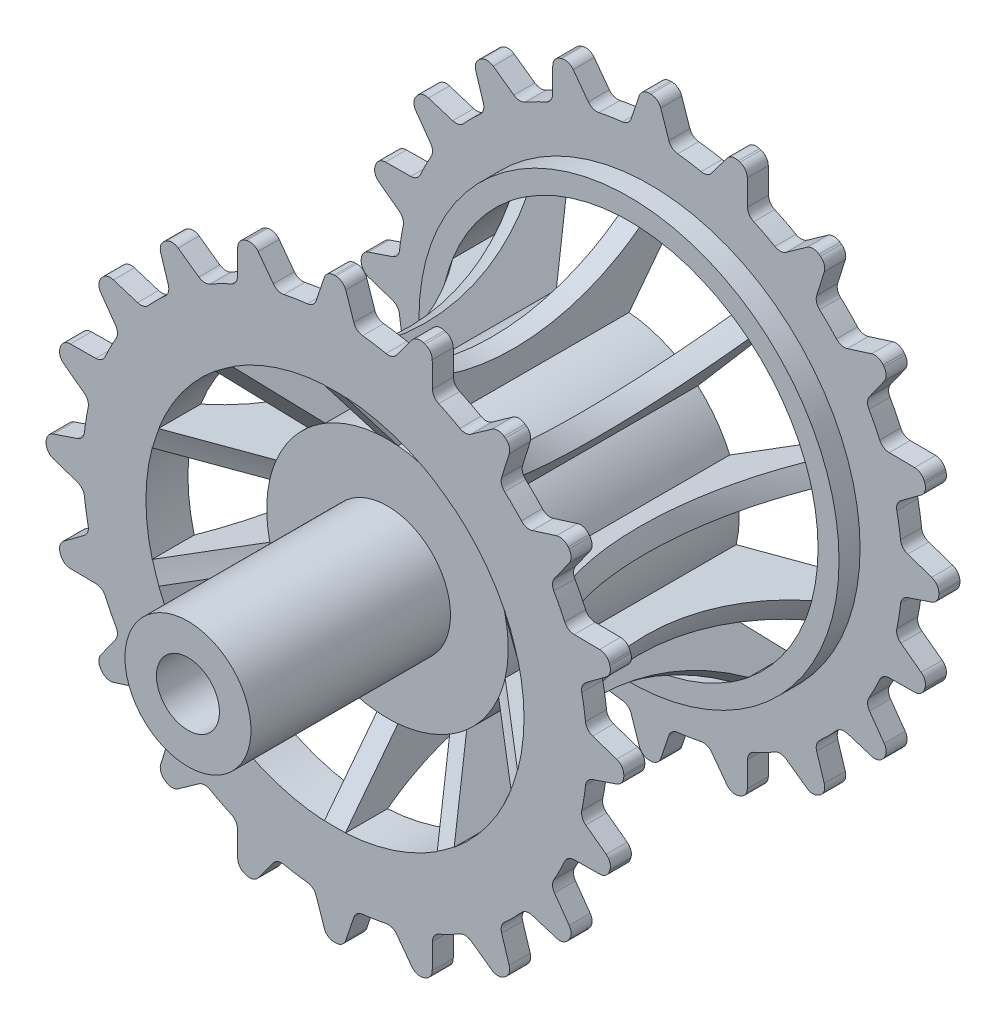
from build123d import *

# Parameters (mm, degrees)
SKETCH_1_R          = 24
EXTRUDE_1_DEPTH     = 32
SKETCH_5_R          = 5.5
CUT_EXTRUDE_1_DEPTH = 14
SKETCH_6_R          = 6
SKETCH_6_R_2        = 3
EXTRUDE_3_DEPTH     = 19
EXTRUDE_6_DEPTH     = 2
EXTRUDE_START       = -2
EXTRUDE_7_DEPTH     = 2


with BuildPart() as part:
    # 草图1 → 凸台-拉伸1 (new body)
    with BuildSketch(Plane.XY):
        Circle(SKETCH_1_R)
        with BuildLine():
            Line((-1, 17.972200756), (-1, 11.456439237))
            ThreePointArc((-1, 11.456439237), (-3.553695435, 10.937149937), (-5.924909033, 9.85623929))
            Line((-5.924909033, 9.85623929), (-9.754777561, 15.12760109))
            ThreePointArc((-9.754777561, 15.12760109), (-5.562305899, 17.119017293), (-1, 17.972200756))
        make_face(mode=Mode.SUBTRACT)
        with BuildLine():
            Line((1, 17.972200756), (1, 11.456439237))
            ThreePointArc((1, 11.456439237), (3.553695435, 10.937149937), (5.924909033, 9.85623929))
            Line((5.924909033, 9.85623929), (9.754777561, 15.12760109))
            ThreePointArc((9.754777561, 15.12760109), (5.562305899, 17.119017293), (1, 17.972200756))
        make_face(mode=Mode.SUBTRACT)
        with BuildLine():
            Line((11.37281155, 13.952030585), (7.542943022, 8.680668786))
            ThreePointArc((7.542943022, 8.680668786), (9.303695435, 6.759530401), (10.586704196, 4.491290936))
            Line((10.586704196, 4.491290936), (16.783561646, 6.504771976))
            ThreePointArc((16.783561646, 6.504771976), (14.562305899, 10.580134541), (11.37281155, 13.952030585))
        make_face(mode=Mode.SUBTRACT)
        with BuildLine():
            Line((17.401595635, 4.602658944), (11.204738185, 2.589177903))
            ThreePointArc((11.204738185, 2.589177903), (11.5, 0), (11.204738185, -2.589177903))
            Line((11.204738185, -2.589177903), (17.401595635, -4.602658944))
            ThreePointArc((17.401595635, -4.602658944), (18, 0), (17.401595635, 4.602658944))
        make_face(mode=Mode.SUBTRACT)
        with BuildLine():
            Line((16.783561646, -6.504771976), (10.586704196, -4.491290936))
            ThreePointArc((10.586704196, -4.491290936), (9.303695435, -6.759530401), (7.542943022, -8.680668786))
            Line((7.542943022, -8.680668786), (11.37281155, -13.952030585))
            ThreePointArc((11.37281155, -13.952030585), (14.562305899, -10.580134541), (16.783561646, -6.504771976))
        make_face(mode=Mode.SUBTRACT)
        with BuildLine():
            Line((9.754777561, -15.12760109), (5.924909033, -9.85623929))
            ThreePointArc((5.924909033, -9.85623929), (3.553695435, -10.937149937), (1, -11.456439237))
            Line((1, -11.456439237), (1, -17.972200756))
            ThreePointArc((1, -17.972200756), (5.562305899, -17.119017293), (9.754777561, -15.12760109))
        make_face(mode=Mode.SUBTRACT)
        with BuildLine():
            Line((-1, -17.972200756), (-1, -11.456439237))
            ThreePointArc((-1, -11.456439237), (-3.553695435, -10.937149937), (-5.924909033, -9.85623929))
            Line((-5.924909033, -9.85623929), (-9.754777561, -15.12760109))
            ThreePointArc((-9.754777561, -15.12760109), (-5.562305899, -17.119017293), (-1, -17.972200756))
        make_face(mode=Mode.SUBTRACT)
        with BuildLine():
            Line((-11.37281155, -13.952030585), (-7.542943022, -8.680668786))
            ThreePointArc((-7.542943022, -8.680668786), (-9.303695435, -6.759530401), (-10.586704196, -4.491290936))
            Line((-10.586704196, -4.491290936), (-16.783561646, -6.504771976))
            ThreePointArc((-16.783561646, -6.504771976), (-14.562305899, -10.580134541), (-11.37281155, -13.952030585))
        make_face(mode=Mode.SUBTRACT)
        with BuildLine():
            Line((-17.401595635, -4.602658944), (-11.204738185, -2.589177903))
            ThreePointArc((-11.204738185, -2.589177903), (-11.5, 0), (-11.204738185, 2.589177903))
            Line((-11.204738185, 2.589177903), (-17.401595635, 4.602658944))
            ThreePointArc((-17.401595635, 4.602658944), (-18, 0), (-17.401595635, -4.602658944))
        make_face(mode=Mode.SUBTRACT)
        with BuildLine():
            Line((-16.783561646, 6.504771976), (-10.586704196, 4.491290936))
            ThreePointArc((-10.586704196, 4.491290936), (-9.303695435, 6.759530401), (-7.542943022, 8.680668786))
            Line((-7.542943022, 8.680668786), (-11.37281155, 13.952030585))
            ThreePointArc((-11.37281155, 13.952030585), (-14.562305899, 10.580134541), (-16.783561646, 6.504771976))
        make_face(mode=Mode.SUBTRACT)
    extrude(amount=EXTRUDE_1_DEPTH)

    # 草图2 → 切除-旋转1 (revolve, cut)
    with BuildSketch(Plane(origin=(0, 0, 0), x_dir=(0, 0, -1), z_dir=(1, 0, 0)), mode=Mode.PRIVATE) as cut_revolve_1_sk:
        with BuildLine():
            Line((-30, 24), (-30, 20))
            Line((-30, 20), (-28, 20))
            Line((-28, 20), (-28, 18))
            ThreePointArc((-28, 18), (-16, 14), (-4, 18))
            Line((-4, 18), (-4, 20))
            Line((-4, 20), (-2, 20))
            Line((-2, 20), (-2, 24))
            Line((-2, 24), (-30, 24))
        make_face()
        Polygon((-5, 11.5), (-5, 0), (0, 0), (0, 18), align=None)
        Polygon((-32, 17.972200756), (-32, 0), (-27, 0), (-27, 11.5), align=None)
    revolve(cut_revolve_1_sk.sketch.rotate(Axis((0, 0, 0), (0, 0, 1)), 90), axis=Axis((0, 0, 0), (0, 0, 1)), mode=Mode.SUBTRACT)

    # 草图5 → 切除-拉伸1 (cut)
    with BuildSketch(Plane(origin=(0, 0, 5), x_dir=(-1, 0, 0), z_dir=(0, 0, -1))):
        Circle(SKETCH_5_R)
    extrude(amount=-CUT_EXTRUDE_1_DEPTH, mode=Mode.SUBTRACT)

    # 草图6 → 凸台-拉伸3 (add)
    with BuildSketch(Plane.XY.offset(27)):
        with Locations(Location((0, 0, 0), (0, 0, 180))):
            Circle(SKETCH_6_R)
        with Locations(Location((0, 0, 0), (0, 0, 180))):
            Circle(SKETCH_6_R_2, mode=Mode.SUBTRACT)
    extrude(amount=EXTRUDE_3_DEPTH)

    # 草图7 → 凸台-拉伸6 (add)
    with BuildSketch(Plane(origin=(0, 0, 0), x_dir=(-1, 0, 0), z_dir=(0, 0, -1))):
        with BuildLine():
            Line((-1.025095629, 26.818356589), (-1.793642425, 24.530751633))
            ThreePointArc((-1.793642425, 24.530751633), (-2.114118535, 24.070569501), (-2.631912696, 23.85525174))
            ThreePointArc((-2.631912696, 23.85525174), (0, 24), (2.631912696, 23.85525174))
            ThreePointArc((2.631912696, 23.85525174), (2.114118535, 24.070569501), (1.793642425, 24.530751633))
            Line((1.793642425, 24.530751633), (1.025095629, 26.818356589))
            ThreePointArc((1.025095629, 26.818356589), (0.66209506, 27.310969468), (0.080074115, 27.49988342))
            ThreePointArc((0.080074115, 27.49988342), (0, 27.5), (-0.080074115, 27.49988342))
            ThreePointArc((-0.080074115, 27.49988342), (-0.66209506, 27.310969468), (-1.025095629, 26.818356589))
        make_face()
        with BuildLine():
            Line((7.312404069, 25.82254476), (5.874563823, 23.884397181))
            ThreePointArc((5.874563823, 23.884397181), (5.427568831, 23.54577053), (4.868580473, 23.500998366))
            ThreePointArc((4.868580473, 23.500998366), (7.416407865, 22.825356391), (9.874775912, 21.874386864))
            ThreePointArc((9.874775912, 21.874386864), (9.448861249, 22.23917342), (9.286274456, 22.775865199))
            Line((9.286274456, 22.775865199), (9.262251825, 25.18900082))
            ThreePointArc((9.262251825, 25.18900082), (9.06924352, 25.769676853), (8.574086329, 26.129199062))
            ThreePointArc((8.574086329, 26.129199062), (8.497967345, 26.154054198), (8.421776311, 26.178687587))
            ThreePointArc((8.421776311, 26.178687587), (7.809863877, 26.178874105), (7.312404069, 25.82254476))
        make_face()
        with BuildLine():
            Line((14.934114709, 22.299042334), (12.967726834, 20.900071521))
            ThreePointArc((12.967726834, 20.900071521), (12.437967944, 20.716147487), (11.892503064, 20.84630353))
            ThreePointArc((11.892503064, 20.84630353), (14.106846055, 19.416407865), (16.151027261, 17.752304594))
            ThreePointArc((16.151027261, 17.752304594), (15.85868359, 18.230852094), (15.869901241, 18.791518391))
            Line((15.869901241, 18.791518391), (16.592754278, 21.093970148))
            ThreePointArc((16.592754278, 21.093970148), (16.588631235, 21.705868721), (16.228807234, 22.200806646))
            ThreePointArc((16.228807234, 22.200806646), (16.164094438, 22.247967345), (16.099244594, 22.294939414))
            ThreePointArc((16.099244594, 22.294939414), (15.517338924, 22.484208145), (14.934114709, 22.299042334))
        make_face()
        with BuildLine():
            Line((21.093970148, 16.592754278), (18.791518391, 15.869901241))
            ThreePointArc((18.791518391, 15.869901241), (18.230852094, 15.85868359), (17.752304594, 16.151027261))
            ThreePointArc((17.752304594, 16.151027261), (19.416407865, 14.106846055), (20.84630353, 11.892503064))
            ThreePointArc((20.84630353, 11.892503064), (20.716147487, 12.437967944), (20.900071521, 12.967726834))
            Line((20.900071521, 12.967726834), (22.299042334, 14.934114709))
            ThreePointArc((22.299042334, 14.934114709), (22.484208145, 15.517338924), (22.294939414, 16.099244594))
            ThreePointArc((22.294939414, 16.099244594), (22.247967345, 16.164094438), (22.200806646, 16.228807234))
            ThreePointArc((22.200806646, 16.228807234), (21.705868721, 16.588631235), (21.093970148, 16.592754278))
        make_face()
        with BuildLine():
            Line((25.18900082, 9.262251825), (22.775865199, 9.286274456))
            ThreePointArc((22.775865199, 9.286274456), (22.23917342, 9.448861249), (21.874386864, 9.874775912))
            ThreePointArc((21.874386864, 9.874775912), (22.825356391, 7.416407865), (23.500998366, 4.868580473))
            ThreePointArc((23.500998366, 4.868580473), (23.54577053, 5.427568831), (23.884397181, 5.874563823))
            Line((23.884397181, 5.874563823), (25.82254476, 7.312404069))
            ThreePointArc((25.82254476, 7.312404069), (26.178874105, 7.809863877), (26.178687587, 8.421776311))
            ThreePointArc((26.178687587, 8.421776311), (26.154054198, 8.497967345), (26.129199062, 8.574086329))
            ThreePointArc((26.129199062, 8.574086329), (25.769676853, 9.06924352), (25.18900082, 9.262251825))
        make_face()
        with BuildLine():
            Line((26.818356589, 1.025095629), (24.530751633, 1.793642425))
            ThreePointArc((24.530751633, 1.793642425), (24.070569501, 2.114118535), (23.85525174, 2.631912696))
            ThreePointArc((23.85525174, 2.631912696), (24, 0), (23.85525174, -2.631912696))
            ThreePointArc((23.85525174, -2.631912696), (24.070569501, -2.114118535), (24.530751633, -1.793642425))
            Line((24.530751633, -1.793642425), (26.818356589, -1.025095629))
            ThreePointArc((26.818356589, -1.025095629), (27.310969468, -0.66209506), (27.49988342, -0.080074115))
            ThreePointArc((27.49988342, -0.080074115), (27.5, 0), (27.49988342, 0.080074115))
            ThreePointArc((27.49988342, 0.080074115), (27.310969468, 0.66209506), (26.818356589, 1.025095629))
        make_face()
        with BuildLine():
            Line((25.82254476, -7.312404069), (23.884397181, -5.874563823))
            ThreePointArc((23.884397181, -5.874563823), (23.54577053, -5.427568831), (23.500998366, -4.868580473))
            ThreePointArc((23.500998366, -4.868580473), (22.825356391, -7.416407865), (21.874386864, -9.874775912))
            ThreePointArc((21.874386864, -9.874775912), (22.23917342, -9.448861249), (22.775865199, -9.286274456))
            Line((22.775865199, -9.286274456), (25.18900082, -9.262251825))
            ThreePointArc((25.18900082, -9.262251825), (25.769676853, -9.06924352), (26.129199062, -8.574086329))
            ThreePointArc((26.129199062, -8.574086329), (26.154054198, -8.497967345), (26.178687587, -8.421776311))
            ThreePointArc((26.178687587, -8.421776311), (26.178874105, -7.809863877), (25.82254476, -7.312404069))
        make_face()
        with BuildLine():
            Line((22.299042334, -14.934114709), (20.900071521, -12.967726834))
            ThreePointArc((20.900071521, -12.967726834), (20.716147487, -12.437967944), (20.84630353, -11.892503064))
            ThreePointArc((20.84630353, -11.892503064), (19.416407865, -14.106846055), (17.752304594, -16.151027261))
            ThreePointArc((17.752304594, -16.151027261), (18.230852094, -15.85868359), (18.791518391, -15.869901241))
            Line((18.791518391, -15.869901241), (21.093970148, -16.592754278))
            ThreePointArc((21.093970148, -16.592754278), (21.705868721, -16.588631235), (22.200806646, -16.228807234))
            ThreePointArc((22.200806646, -16.228807234), (22.247967345, -16.164094438), (22.294939414, -16.099244594))
            ThreePointArc((22.294939414, -16.099244594), (22.484208145, -15.517338924), (22.299042334, -14.934114709))
        make_face()
        with BuildLine():
            Line((16.592754278, -21.093970148), (15.869901241, -18.791518391))
            ThreePointArc((15.869901241, -18.791518391), (15.85868359, -18.230852094), (16.151027261, -17.752304594))
            ThreePointArc((16.151027261, -17.752304594), (14.106846055, -19.416407865), (11.892503064, -20.84630353))
            ThreePointArc((11.892503064, -20.84630353), (12.437967944, -20.716147487), (12.967726834, -20.900071521))
            Line((12.967726834, -20.900071521), (14.934114709, -22.299042334))
            ThreePointArc((14.934114709, -22.299042334), (15.517338924, -22.484208145), (16.099244594, -22.294939414))
            ThreePointArc((16.099244594, -22.294939414), (16.164094438, -22.247967345), (16.228807234, -22.200806646))
            ThreePointArc((16.228807234, -22.200806646), (16.588631235, -21.705868721), (16.592754278, -21.093970148))
        make_face()
        with BuildLine():
            Line((9.262251825, -25.18900082), (9.286274456, -22.775865199))
            ThreePointArc((9.286274456, -22.775865199), (9.448861249, -22.23917342), (9.874775912, -21.874386864))
            ThreePointArc((9.874775912, -21.874386864), (7.416407865, -22.825356391), (4.868580473, -23.500998366))
            ThreePointArc((4.868580473, -23.500998366), (5.427568831, -23.54577053), (5.874563823, -23.884397181))
            Line((5.874563823, -23.884397181), (7.312404069, -25.82254476))
            ThreePointArc((7.312404069, -25.82254476), (7.809863877, -26.178874105), (8.421776311, -26.178687587))
            ThreePointArc((8.421776311, -26.178687587), (8.497967345, -26.154054198), (8.574086329, -26.129199062))
            ThreePointArc((8.574086329, -26.129199062), (9.06924352, -25.769676853), (9.262251825, -25.18900082))
        make_face()
        with BuildLine():
            Line((1.025095629, -26.818356589), (1.793642425, -24.530751633))
            ThreePointArc((1.793642425, -24.530751633), (2.114118535, -24.070569501), (2.631912696, -23.85525174))
            ThreePointArc((2.631912696, -23.85525174), (0, -24), (-2.631912696, -23.85525174))
            ThreePointArc((-2.631912696, -23.85525174), (-2.114118535, -24.070569501), (-1.793642425, -24.530751633))
            Line((-1.793642425, -24.530751633), (-1.025095629, -26.818356589))
            ThreePointArc((-1.025095629, -26.818356589), (-0.66209506, -27.310969468), (-0.080074115, -27.49988342))
            ThreePointArc((-0.080074115, -27.49988342), (0, -27.5), (0.080074115, -27.49988342))
            ThreePointArc((0.080074115, -27.49988342), (0.66209506, -27.310969468), (1.025095629, -26.818356589))
        make_face()
        with BuildLine():
            Line((-7.312404069, -25.82254476), (-5.874563823, -23.884397181))
            ThreePointArc((-5.874563823, -23.884397181), (-5.427568831, -23.54577053), (-4.868580473, -23.500998366))
            ThreePointArc((-4.868580473, -23.500998366), (-7.416407865, -22.825356391), (-9.874775912, -21.874386864))
            ThreePointArc((-9.874775912, -21.874386864), (-9.448861249, -22.23917342), (-9.286274456, -22.775865199))
            Line((-9.286274456, -22.775865199), (-9.262251825, -25.18900082))
            ThreePointArc((-9.262251825, -25.18900082), (-9.06924352, -25.769676853), (-8.574086329, -26.129199062))
            ThreePointArc((-8.574086329, -26.129199062), (-8.497967345, -26.154054198), (-8.421776311, -26.178687587))
            ThreePointArc((-8.421776311, -26.178687587), (-7.809863877, -26.178874105), (-7.312404069, -25.82254476))
        make_face()
        with BuildLine():
            Line((-14.934114709, -22.299042334), (-12.967726834, -20.900071521))
            ThreePointArc((-12.967726834, -20.900071521), (-12.437967944, -20.716147487), (-11.892503064, -20.84630353))
            ThreePointArc((-11.892503064, -20.84630353), (-14.106846055, -19.416407865), (-16.151027261, -17.752304594))
            ThreePointArc((-16.151027261, -17.752304594), (-15.85868359, -18.230852094), (-15.869901241, -18.791518391))
            Line((-15.869901241, -18.791518391), (-16.592754278, -21.093970148))
            ThreePointArc((-16.592754278, -21.093970148), (-16.588631235, -21.705868721), (-16.228807234, -22.200806646))
            ThreePointArc((-16.228807234, -22.200806646), (-16.164094438, -22.247967345), (-16.099244594, -22.294939414))
            ThreePointArc((-16.099244594, -22.294939414), (-15.517338924, -22.484208145), (-14.934114709, -22.299042334))
        make_face()
        with BuildLine():
            Line((-21.093970148, -16.592754278), (-18.791518391, -15.869901241))
            ThreePointArc((-18.791518391, -15.869901241), (-18.230852094, -15.85868359), (-17.752304594, -16.151027261))
            ThreePointArc((-17.752304594, -16.151027261), (-19.416407865, -14.106846055), (-20.84630353, -11.892503064))
            ThreePointArc((-20.84630353, -11.892503064), (-20.716147487, -12.437967944), (-20.900071521, -12.967726834))
            Line((-20.900071521, -12.967726834), (-22.299042334, -14.934114709))
            ThreePointArc((-22.299042334, -14.934114709), (-22.484208145, -15.517338924), (-22.294939414, -16.099244594))
            ThreePointArc((-22.294939414, -16.099244594), (-22.247967345, -16.164094438), (-22.200806646, -16.228807234))
            ThreePointArc((-22.200806646, -16.228807234), (-21.705868721, -16.588631235), (-21.093970148, -16.592754278))
        make_face()
        with BuildLine():
            Line((-25.18900082, -9.262251825), (-22.775865199, -9.286274456))
            ThreePointArc((-22.775865199, -9.286274456), (-22.23917342, -9.448861249), (-21.874386864, -9.874775912))
            ThreePointArc((-21.874386864, -9.874775912), (-22.825356391, -7.416407865), (-23.500998366, -4.868580473))
            ThreePointArc((-23.500998366, -4.868580473), (-23.54577053, -5.427568831), (-23.884397181, -5.874563823))
            Line((-23.884397181, -5.874563823), (-25.82254476, -7.312404069))
            ThreePointArc((-25.82254476, -7.312404069), (-26.178874105, -7.809863877), (-26.178687587, -8.421776311))
            ThreePointArc((-26.178687587, -8.421776311), (-26.154054198, -8.497967345), (-26.129199062, -8.574086329))
            ThreePointArc((-26.129199062, -8.574086329), (-25.769676853, -9.06924352), (-25.18900082, -9.262251825))
        make_face()
        with BuildLine():
            Line((-26.818356589, -1.025095629), (-24.530751633, -1.793642425))
            ThreePointArc((-24.530751633, -1.793642425), (-24.070569501, -2.114118535), (-23.85525174, -2.631912696))
            ThreePointArc((-23.85525174, -2.631912696), (-24, 0), (-23.85525174, 2.631912696))
            ThreePointArc((-23.85525174, 2.631912696), (-24.070569501, 2.114118535), (-24.530751633, 1.793642425))
            Line((-24.530751633, 1.793642425), (-26.818356589, 1.025095629))
            ThreePointArc((-26.818356589, 1.025095629), (-27.310969468, 0.66209506), (-27.49988342, 0.080074115))
            ThreePointArc((-27.49988342, 0.080074115), (-27.5, 0), (-27.49988342, -0.080074115))
            ThreePointArc((-27.49988342, -0.080074115), (-27.310969468, -0.66209506), (-26.818356589, -1.025095629))
        make_face()
        with BuildLine():
            Line((-25.82254476, 7.312404069), (-23.884397181, 5.874563823))
            ThreePointArc((-23.884397181, 5.874563823), (-23.54577053, 5.427568831), (-23.500998366, 4.868580473))
            ThreePointArc((-23.500998366, 4.868580473), (-22.825356391, 7.416407865), (-21.874386864, 9.874775912))
            ThreePointArc((-21.874386864, 9.874775912), (-22.23917342, 9.448861249), (-22.775865199, 9.286274456))
            Line((-22.775865199, 9.286274456), (-25.18900082, 9.262251825))
            ThreePointArc((-25.18900082, 9.262251825), (-25.769676853, 9.06924352), (-26.129199062, 8.574086329))
            ThreePointArc((-26.129199062, 8.574086329), (-26.154054198, 8.497967345), (-26.178687587, 8.421776311))
            ThreePointArc((-26.178687587, 8.421776311), (-26.178874105, 7.809863877), (-25.82254476, 7.312404069))
        make_face()
        with BuildLine():
            Line((-22.299042334, 14.934114709), (-20.900071521, 12.967726834))
            ThreePointArc((-20.900071521, 12.967726834), (-20.716147487, 12.437967944), (-20.84630353, 11.892503064))
            ThreePointArc((-20.84630353, 11.892503064), (-19.416407865, 14.106846055), (-17.752304594, 16.151027261))
            ThreePointArc((-17.752304594, 16.151027261), (-18.230852094, 15.85868359), (-18.791518391, 15.869901241))
            Line((-18.791518391, 15.869901241), (-21.093970148, 16.592754278))
            ThreePointArc((-21.093970148, 16.592754278), (-21.705868721, 16.588631235), (-22.200806646, 16.228807234))
            ThreePointArc((-22.200806646, 16.228807234), (-22.247967345, 16.164094438), (-22.294939414, 16.099244594))
            ThreePointArc((-22.294939414, 16.099244594), (-22.484208145, 15.517338924), (-22.299042334, 14.934114709))
        make_face()
        with BuildLine():
            Line((-16.592754278, 21.093970148), (-15.869901241, 18.791518391))
            ThreePointArc((-15.869901241, 18.791518391), (-15.85868359, 18.230852094), (-16.151027261, 17.752304594))
            ThreePointArc((-16.151027261, 17.752304594), (-14.106846055, 19.416407865), (-11.892503064, 20.84630353))
            ThreePointArc((-11.892503064, 20.84630353), (-12.437967944, 20.716147487), (-12.967726834, 20.900071521))
            Line((-12.967726834, 20.900071521), (-14.934114709, 22.299042334))
            ThreePointArc((-14.934114709, 22.299042334), (-15.517338924, 22.484208145), (-16.099244594, 22.294939414))
            ThreePointArc((-16.099244594, 22.294939414), (-16.164094438, 22.247967345), (-16.228807234, 22.200806646))
            ThreePointArc((-16.228807234, 22.200806646), (-16.588631235, 21.705868721), (-16.592754278, 21.093970148))
        make_face()
        with BuildLine():
            Line((-9.262251825, 25.18900082), (-9.286274456, 22.775865199))
            ThreePointArc((-9.286274456, 22.775865199), (-9.448861249, 22.23917342), (-9.874775912, 21.874386864))
            ThreePointArc((-9.874775912, 21.874386864), (-7.416407865, 22.825356391), (-4.868580473, 23.500998366))
            ThreePointArc((-4.868580473, 23.500998366), (-5.427568831, 23.54577053), (-5.874563823, 23.884397181))
            Line((-5.874563823, 23.884397181), (-7.312404069, 25.82254476))
            ThreePointArc((-7.312404069, 25.82254476), (-7.809863877, 26.178874105), (-8.421776311, 26.178687587))
            ThreePointArc((-8.421776311, 26.178687587), (-8.497967345, 26.154054198), (-8.574086329, 26.129199062))
            ThreePointArc((-8.574086329, 26.129199062), (-9.06924352, 25.769676853), (-9.262251825, 25.18900082))
        make_face()
    extrude(amount=-EXTRUDE_6_DEPTH)

    # 草图9 → 凸台-拉伸7 (add)
    with BuildSketch(Plane.XY.offset(32).offset(EXTRUDE_START)):
        with BuildLine():
            Line((-1.025095629, 26.818356589), (-1.793642425, 24.530751633))
            ThreePointArc((-1.793642425, 24.530751633), (-2.114118535, 24.070569501), (-2.631912696, 23.85525174))
            ThreePointArc((-2.631912696, 23.85525174), (0, 24), (2.631912696, 23.85525174))
            ThreePointArc((2.631912696, 23.85525174), (2.114118535, 24.070569501), (1.793642425, 24.530751633))
            Line((1.793642425, 24.530751633), (1.025095629, 26.818356589))
            ThreePointArc((1.025095629, 26.818356589), (0.66209506, 27.310969468), (0.080074115, 27.49988342))
            ThreePointArc((0.080074115, 27.49988342), (0, 27.5), (-0.080074115, 27.49988342))
            ThreePointArc((-0.080074115, 27.49988342), (-0.66209506, 27.310969468), (-1.025095629, 26.818356589))
        make_face()
        with BuildLine():
            Line((-12.967726834, 20.900071521), (-14.934114709, 22.299042334))
            ThreePointArc((-14.934114709, 22.299042334), (-15.517338924, 22.484208145), (-16.099244594, 22.294939414))
            ThreePointArc((-16.099244594, 22.294939414), (-16.164094438, 22.247967345), (-16.228807234, 22.200806646))
            ThreePointArc((-16.228807234, 22.200806646), (-16.588631235, 21.705868721), (-16.592754278, 21.093970148))
            Line((-16.592754278, 21.093970148), (-15.869901241, 18.791518391))
            ThreePointArc((-15.869901241, 18.791518391), (-15.85868359, 18.230852094), (-16.151027261, 17.752304594))
            ThreePointArc((-16.151027261, 17.752304594), (-14.106846055, 19.416407865), (-11.892503064, 20.84630353))
            ThreePointArc((-11.892503064, 20.84630353), (-12.437967944, 20.716147487), (-12.967726834, 20.900071521))
        make_face()
        with BuildLine():
            Line((-9.262251825, 25.18900082), (-9.286274456, 22.775865199))
            ThreePointArc((-9.286274456, 22.775865199), (-9.448861249, 22.23917342), (-9.874775912, 21.874386864))
            ThreePointArc((-9.874775912, 21.874386864), (-7.416407865, 22.825356391), (-4.868580473, 23.500998366))
            ThreePointArc((-4.868580473, 23.500998366), (-5.427568831, 23.54577053), (-5.874563823, 23.884397181))
            Line((-5.874563823, 23.884397181), (-7.312404069, 25.82254476))
            ThreePointArc((-7.312404069, 25.82254476), (-7.809863877, 26.178874105), (-8.421776311, 26.178687587))
            ThreePointArc((-8.421776311, 26.178687587), (-8.497967345, 26.154054198), (-8.574086329, 26.129199062))
            ThreePointArc((-8.574086329, 26.129199062), (-9.06924352, 25.769676853), (-9.262251825, 25.18900082))
        make_face()
        with BuildLine():
            Line((-22.299042334, 14.934114709), (-20.900071521, 12.967726834))
            ThreePointArc((-20.900071521, 12.967726834), (-20.716147487, 12.437967944), (-20.84630353, 11.892503064))
            ThreePointArc((-20.84630353, 11.892503064), (-19.416407865, 14.106846055), (-17.752304594, 16.151027261))
            ThreePointArc((-17.752304594, 16.151027261), (-18.230852094, 15.85868359), (-18.791518391, 15.869901241))
            Line((-18.791518391, 15.869901241), (-21.093970148, 16.592754278))
            ThreePointArc((-21.093970148, 16.592754278), (-21.705868721, 16.588631235), (-22.200806646, 16.228807234))
            ThreePointArc((-22.200806646, 16.228807234), (-22.247967345, 16.164094438), (-22.294939414, 16.099244594))
            ThreePointArc((-22.294939414, 16.099244594), (-22.484208145, 15.517338924), (-22.299042334, 14.934114709))
        make_face()
        with BuildLine():
            Line((-25.82254476, 7.312404069), (-23.884397181, 5.874563823))
            ThreePointArc((-23.884397181, 5.874563823), (-23.54577053, 5.427568831), (-23.500998366, 4.868580473))
            ThreePointArc((-23.500998366, 4.868580473), (-22.825356391, 7.416407865), (-21.874386864, 9.874775912))
            ThreePointArc((-21.874386864, 9.874775912), (-22.23917342, 9.448861249), (-22.775865199, 9.286274456))
            Line((-22.775865199, 9.286274456), (-25.18900082, 9.262251825))
            ThreePointArc((-25.18900082, 9.262251825), (-25.769676853, 9.06924352), (-26.129199062, 8.574086329))
            ThreePointArc((-26.129199062, 8.574086329), (-26.154054198, 8.497967345), (-26.178687587, 8.421776311))
            ThreePointArc((-26.178687587, 8.421776311), (-26.178874105, 7.809863877), (-25.82254476, 7.312404069))
        make_face()
        with BuildLine():
            Line((-23.884397181, -5.874563823), (-25.82254476, -7.312404069))
            ThreePointArc((-25.82254476, -7.312404069), (-26.178874105, -7.809863877), (-26.178687587, -8.421776311))
            ThreePointArc((-26.178687587, -8.421776311), (-26.154054198, -8.497967345), (-26.129199062, -8.574086329))
            ThreePointArc((-26.129199062, -8.574086329), (-25.769676853, -9.06924352), (-25.18900082, -9.262251825))
            Line((-25.18900082, -9.262251825), (-22.775865199, -9.286274456))
            ThreePointArc((-22.775865199, -9.286274456), (-22.23917342, -9.448861249), (-21.874386864, -9.874775912))
            ThreePointArc((-21.874386864, -9.874775912), (-22.825356391, -7.416407865), (-23.500998366, -4.868580473))
            ThreePointArc((-23.500998366, -4.868580473), (-23.54577053, -5.427568831), (-23.884397181, -5.874563823))
        make_face()
        with BuildLine():
            Line((-26.818356589, -1.025095629), (-24.530751633, -1.793642425))
            ThreePointArc((-24.530751633, -1.793642425), (-24.070569501, -2.114118535), (-23.85525174, -2.631912696))
            ThreePointArc((-23.85525174, -2.631912696), (-24, 0), (-23.85525174, 2.631912696))
            ThreePointArc((-23.85525174, 2.631912696), (-24.070569501, 2.114118535), (-24.530751633, 1.793642425))
            Line((-24.530751633, 1.793642425), (-26.818356589, 1.025095629))
            ThreePointArc((-26.818356589, 1.025095629), (-27.310969468, 0.66209506), (-27.49988342, 0.080074115))
            ThreePointArc((-27.49988342, 0.080074115), (-27.5, 0), (-27.49988342, -0.080074115))
            ThreePointArc((-27.49988342, -0.080074115), (-27.310969468, -0.66209506), (-26.818356589, -1.025095629))
        make_face()
        with BuildLine():
            Line((-21.093970148, -16.592754278), (-18.791518391, -15.869901241))
            ThreePointArc((-18.791518391, -15.869901241), (-18.230852094, -15.85868359), (-17.752304594, -16.151027261))
            ThreePointArc((-17.752304594, -16.151027261), (-19.416407865, -14.106846055), (-20.84630353, -11.892503064))
            ThreePointArc((-20.84630353, -11.892503064), (-20.716147487, -12.437967944), (-20.900071521, -12.967726834))
            Line((-20.900071521, -12.967726834), (-22.299042334, -14.934114709))
            ThreePointArc((-22.299042334, -14.934114709), (-22.484208145, -15.517338924), (-22.294939414, -16.099244594))
            ThreePointArc((-22.294939414, -16.099244594), (-22.247967345, -16.164094438), (-22.200806646, -16.228807234))
            ThreePointArc((-22.200806646, -16.228807234), (-21.705868721, -16.588631235), (-21.093970148, -16.592754278))
        make_face()
        with BuildLine():
            Line((-14.934114709, -22.299042334), (-12.967726834, -20.900071521))
            ThreePointArc((-12.967726834, -20.900071521), (-12.437967944, -20.716147487), (-11.892503064, -20.84630353))
            ThreePointArc((-11.892503064, -20.84630353), (-14.106846055, -19.416407865), (-16.151027261, -17.752304594))
            ThreePointArc((-16.151027261, -17.752304594), (-15.85868359, -18.230852094), (-15.869901241, -18.791518391))
            Line((-15.869901241, -18.791518391), (-16.592754278, -21.093970148))
            ThreePointArc((-16.592754278, -21.093970148), (-16.588631235, -21.705868721), (-16.228807234, -22.200806646))
            ThreePointArc((-16.228807234, -22.200806646), (-16.164094438, -22.247967345), (-16.099244594, -22.294939414))
            ThreePointArc((-16.099244594, -22.294939414), (-15.517338924, -22.484208145), (-14.934114709, -22.299042334))
        make_face()
        with BuildLine():
            Line((-1.793642425, -24.530751633), (-1.025095629, -26.818356589))
            ThreePointArc((-1.025095629, -26.818356589), (-0.66209506, -27.310969468), (-0.080074115, -27.49988342))
            ThreePointArc((-0.080074115, -27.49988342), (0, -27.5), (0.080074115, -27.49988342))
            ThreePointArc((0.080074115, -27.49988342), (0.66209506, -27.310969468), (1.025095629, -26.818356589))
            Line((1.025095629, -26.818356589), (1.793642425, -24.530751633))
            ThreePointArc((1.793642425, -24.530751633), (2.114118535, -24.070569501), (2.631912696, -23.85525174))
            ThreePointArc((2.631912696, -23.85525174), (0, -24), (-2.631912696, -23.85525174))
            ThreePointArc((-2.631912696, -23.85525174), (-2.114118535, -24.070569501), (-1.793642425, -24.530751633))
        make_face()
        with BuildLine():
            Line((-7.312404069, -25.82254476), (-5.874563823, -23.884397181))
            ThreePointArc((-5.874563823, -23.884397181), (-5.427568831, -23.54577053), (-4.868580473, -23.500998366))
            ThreePointArc((-4.868580473, -23.500998366), (-7.416407865, -22.825356391), (-9.874775912, -21.874386864))
            ThreePointArc((-9.874775912, -21.874386864), (-9.448861249, -22.23917342), (-9.286274456, -22.775865199))
            Line((-9.286274456, -22.775865199), (-9.262251825, -25.18900082))
            ThreePointArc((-9.262251825, -25.18900082), (-9.06924352, -25.769676853), (-8.574086329, -26.129199062))
            ThreePointArc((-8.574086329, -26.129199062), (-8.497967345, -26.154054198), (-8.421776311, -26.178687587))
            ThreePointArc((-8.421776311, -26.178687587), (-7.809863877, -26.178874105), (-7.312404069, -25.82254476))
        make_face()
        with BuildLine():
            Line((9.262251825, -25.18900082), (9.286274456, -22.775865199))
            ThreePointArc((9.286274456, -22.775865199), (9.448861249, -22.23917342), (9.874775912, -21.874386864))
            ThreePointArc((9.874775912, -21.874386864), (7.416407865, -22.825356391), (4.868580473, -23.500998366))
            ThreePointArc((4.868580473, -23.500998366), (5.427568831, -23.54577053), (5.874563823, -23.884397181))
            Line((5.874563823, -23.884397181), (7.312404069, -25.82254476))
            ThreePointArc((7.312404069, -25.82254476), (7.809863877, -26.178874105), (8.421776311, -26.178687587))
            ThreePointArc((8.421776311, -26.178687587), (8.497967345, -26.154054198), (8.574086329, -26.129199062))
            ThreePointArc((8.574086329, -26.129199062), (9.06924352, -25.769676853), (9.262251825, -25.18900082))
        make_face()
        with BuildLine():
            Line((16.592754278, -21.093970148), (15.869901241, -18.791518391))
            ThreePointArc((15.869901241, -18.791518391), (15.85868359, -18.230852094), (16.151027261, -17.752304594))
            ThreePointArc((16.151027261, -17.752304594), (14.106846055, -19.416407865), (11.892503064, -20.84630353))
            ThreePointArc((11.892503064, -20.84630353), (12.437967944, -20.716147487), (12.967726834, -20.900071521))
            Line((12.967726834, -20.900071521), (14.934114709, -22.299042334))
            ThreePointArc((14.934114709, -22.299042334), (15.517338924, -22.484208145), (16.099244594, -22.294939414))
            ThreePointArc((16.099244594, -22.294939414), (16.164094438, -22.247967345), (16.228807234, -22.200806646))
            ThreePointArc((16.228807234, -22.200806646), (16.588631235, -21.705868721), (16.592754278, -21.093970148))
        make_face()
        with BuildLine():
            Line((22.775865199, -9.286274456), (25.18900082, -9.262251825))
            ThreePointArc((25.18900082, -9.262251825), (25.769676853, -9.06924352), (26.129199062, -8.574086329))
            ThreePointArc((26.129199062, -8.574086329), (26.154054198, -8.497967345), (26.178687587, -8.421776311))
            ThreePointArc((26.178687587, -8.421776311), (26.178874105, -7.809863877), (25.82254476, -7.312404069))
            Line((25.82254476, -7.312404069), (23.884397181, -5.874563823))
            ThreePointArc((23.884397181, -5.874563823), (23.54577053, -5.427568831), (23.500998366, -4.868580473))
            ThreePointArc((23.500998366, -4.868580473), (22.825356391, -7.416407865), (21.874386864, -9.874775912))
            ThreePointArc((21.874386864, -9.874775912), (22.23917342, -9.448861249), (22.775865199, -9.286274456))
        make_face()
        with BuildLine():
            Line((22.299042334, -14.934114709), (20.900071521, -12.967726834))
            ThreePointArc((20.900071521, -12.967726834), (20.716147487, -12.437967944), (20.84630353, -11.892503064))
            ThreePointArc((20.84630353, -11.892503064), (19.416407865, -14.106846055), (17.752304594, -16.151027261))
            ThreePointArc((17.752304594, -16.151027261), (18.230852094, -15.85868359), (18.791518391, -15.869901241))
            Line((18.791518391, -15.869901241), (21.093970148, -16.592754278))
            ThreePointArc((21.093970148, -16.592754278), (21.705868721, -16.588631235), (22.200806646, -16.228807234))
            ThreePointArc((22.200806646, -16.228807234), (22.247967345, -16.164094438), (22.294939414, -16.099244594))
            ThreePointArc((22.294939414, -16.099244594), (22.484208145, -15.517338924), (22.299042334, -14.934114709))
        make_face()
        with BuildLine():
            Line((26.818356589, 1.025095629), (24.530751633, 1.793642425))
            ThreePointArc((24.530751633, 1.793642425), (24.070569501, 2.114118535), (23.85525174, 2.631912696))
            ThreePointArc((23.85525174, 2.631912696), (24, 0), (23.85525174, -2.631912696))
            ThreePointArc((23.85525174, -2.631912696), (24.070569501, -2.114118535), (24.530751633, -1.793642425))
            Line((24.530751633, -1.793642425), (26.818356589, -1.025095629))
            ThreePointArc((26.818356589, -1.025095629), (27.310969468, -0.66209506), (27.49988342, -0.080074115))
            ThreePointArc((27.49988342, -0.080074115), (27.5, 0), (27.49988342, 0.080074115))
            ThreePointArc((27.49988342, 0.080074115), (27.310969468, 0.66209506), (26.818356589, 1.025095629))
        make_face()
        with BuildLine():
            Line((25.18900082, 9.262251825), (22.775865199, 9.286274456))
            ThreePointArc((22.775865199, 9.286274456), (22.23917342, 9.448861249), (21.874386864, 9.874775912))
            ThreePointArc((21.874386864, 9.874775912), (22.825356391, 7.416407865), (23.500998366, 4.868580473))
            ThreePointArc((23.500998366, 4.868580473), (23.54577053, 5.427568831), (23.884397181, 5.874563823))
            Line((23.884397181, 5.874563823), (25.82254476, 7.312404069))
            ThreePointArc((25.82254476, 7.312404069), (26.178874105, 7.809863877), (26.178687587, 8.421776311))
            ThreePointArc((26.178687587, 8.421776311), (26.154054198, 8.497967345), (26.129199062, 8.574086329))
            ThreePointArc((26.129199062, 8.574086329), (25.769676853, 9.06924352), (25.18900082, 9.262251825))
        make_face()
        with BuildLine():
            Line((15.869901241, 18.791518391), (16.592754278, 21.093970148))
            ThreePointArc((16.592754278, 21.093970148), (16.588631235, 21.705868721), (16.228807234, 22.200806646))
            ThreePointArc((16.228807234, 22.200806646), (16.164094438, 22.247967345), (16.099244594, 22.294939414))
            ThreePointArc((16.099244594, 22.294939414), (15.517338924, 22.484208145), (14.934114709, 22.299042334))
            Line((14.934114709, 22.299042334), (12.967726834, 20.900071521))
            ThreePointArc((12.967726834, 20.900071521), (12.437967944, 20.716147487), (11.892503064, 20.84630353))
            ThreePointArc((11.892503064, 20.84630353), (14.106846055, 19.416407865), (16.151027261, 17.752304594))
            ThreePointArc((16.151027261, 17.752304594), (15.85868359, 18.230852094), (15.869901241, 18.791518391))
        make_face()
        with BuildLine():
            Line((21.093970148, 16.592754278), (18.791518391, 15.869901241))
            ThreePointArc((18.791518391, 15.869901241), (18.230852094, 15.85868359), (17.752304594, 16.151027261))
            ThreePointArc((17.752304594, 16.151027261), (19.416407865, 14.106846055), (20.84630353, 11.892503064))
            ThreePointArc((20.84630353, 11.892503064), (20.716147487, 12.437967944), (20.900071521, 12.967726834))
            Line((20.900071521, 12.967726834), (22.299042334, 14.934114709))
            ThreePointArc((22.299042334, 14.934114709), (22.484208145, 15.517338924), (22.294939414, 16.099244594))
            ThreePointArc((22.294939414, 16.099244594), (22.247967345, 16.164094438), (22.200806646, 16.228807234))
            ThreePointArc((22.200806646, 16.228807234), (21.705868721, 16.588631235), (21.093970148, 16.592754278))
        make_face()
        with BuildLine():
            Line((7.312404069, 25.82254476), (5.874563823, 23.884397181))
            ThreePointArc((5.874563823, 23.884397181), (5.427568831, 23.54577053), (4.868580473, 23.500998366))
            ThreePointArc((4.868580473, 23.500998366), (7.416407865, 22.825356391), (9.874775912, 21.874386864))
            ThreePointArc((9.874775912, 21.874386864), (9.448861249, 22.23917342), (9.286274456, 22.775865199))
            Line((9.286274456, 22.775865199), (9.262251825, 25.18900082))
            ThreePointArc((9.262251825, 25.18900082), (9.06924352, 25.769676853), (8.574086329, 26.129199062))
            ThreePointArc((8.574086329, 26.129199062), (8.497967345, 26.154054198), (8.421776311, 26.178687587))
            ThreePointArc((8.421776311, 26.178687587), (7.809863877, 26.178874105), (7.312404069, 25.82254476))
        make_face()
    extrude(amount=EXTRUDE_7_DEPTH)


solid = part.part
